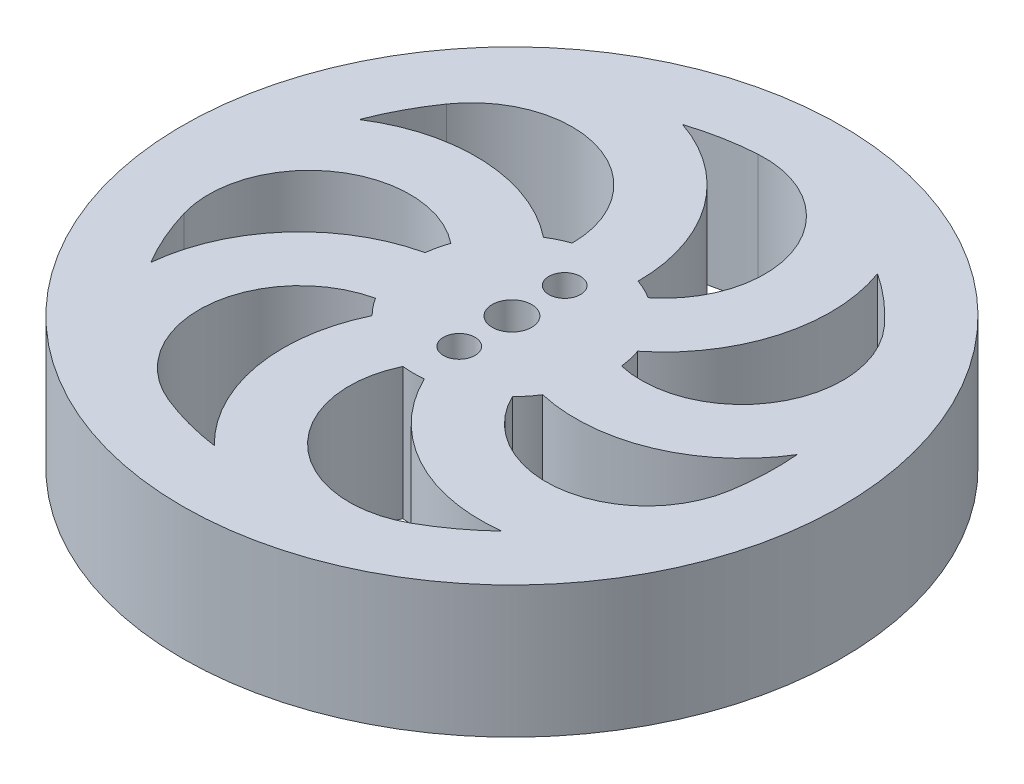
from build123d import *

# Parameters (mm, degrees)
BASE_REFERENCE_SKETCH_R       = 25
BASE_REFERENCE_SKETCH_R_2     = 1.5
BASE_WHEEL_EXTRUDE_DEPTH      = 10
SPOKES_CIRCULAR_PATTERN_COUNT = 7
M2_CLEARANCE_HOLE1_D          = 2.4
CIRPATTERN1_COUNT             = 2


with BuildPart() as part:
    # Base Reference Sketch → Base Wheel Extrude (new body)
    with BuildSketch(Plane(origin=(0, 0, 0), x_dir=(1, 0, 0), z_dir=(0, 1, 0))):
        with Locations(Location((0, 0, 0), (0, 0, 270))):
            Circle(BASE_REFERENCE_SKETCH_R)
        with BuildLine():
            ThreePointArc((-6.099694515, 19.047144847), (11.877442501, -16.091188882), (-16.404494382, 11.440828819))
            ThreePointArc((-16.404494382, 11.440828819), (-7.848653173, 14.358553237), (-2.5, 7.071067812))
            ThreePointArc((-2.5, 7.071067812), (0, -7.5), (2.5, 7.071067812))
            ThreePointArc((2.5, 7.071067812), (0.127377259, 14.442993729), (-6.099694515, 19.047144847))
        make_face(mode=Mode.SUBTRACT)
        with Locations(Location((0, 0, 0), (0, 0, 270))):
            Circle(BASE_REFERENCE_SKETCH_R_2, mode=Mode.SUBTRACT)
    base_wheel_extrude = extrude(amount=BASE_WHEEL_EXTRUDE_DEPTH)

    # Spokes Circular Pattern: Base Wheel Extrude ×7 about axis
    spokes_circular_pattern_axis = Axis((0, 0, 0), (0, 1, 0))
    for i in range(1, SPOKES_CIRCULAR_PATTERN_COUNT):
        add(base_wheel_extrude.rotate(spokes_circular_pattern_axis, i * 360 / SPOKES_CIRCULAR_PATTERN_COUNT))

    # M2 Clearance Hole1 (through all)
    with Locations(Plane(origin=(0, 0, 0), x_dir=(-1, 0, 0), z_dir=(0, -1, 0))):
        with Locations((0, 4)):
            m2_clearance_hole1 = Hole(M2_CLEARANCE_HOLE1_D / 2)

    # CirPattern1: M2 Clearance Hole1 ×2 about axis
    cirpattern1_axis = Axis((0, 0, 0), (0, 1, 0))
    for i in range(1, CIRPATTERN1_COUNT):
        add(m2_clearance_hole1.rotate(cirpattern1_axis, i * 360 / CIRPATTERN1_COUNT), mode=Mode.SUBTRACT)


solid = part.part
